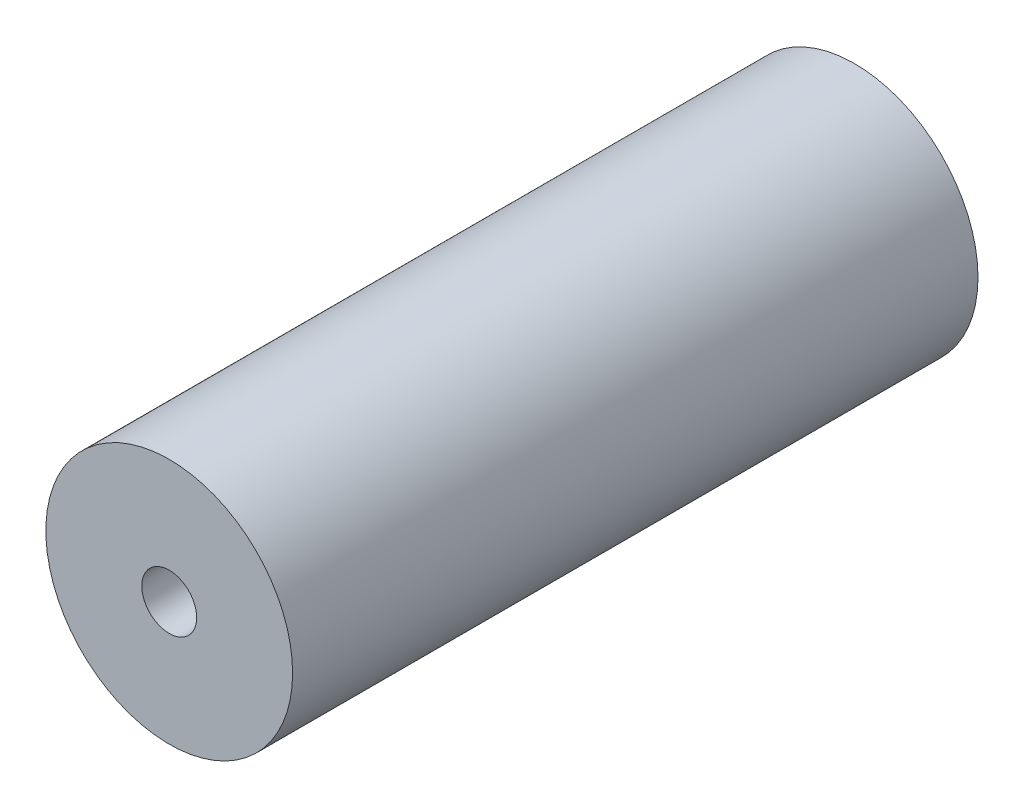
from build123d import *

# Parameters (mm, degrees)
BOSS_EXTRUDE1_DEPTH      = 50
BOSS_EXTRUDE1_DEPTH_BACK = 50
SKETCH2_R                = 18
SKETCH3_R                = 4
CUT_EXTRUDE1_DEPTH       = 122
SKETCH4_R                = 1.5
CUT_EXTRUDE2_DEPTH       = 5


with BuildPart() as part:
    # Sketch2 → Boss-Extrude1 (new, two sides: drawn at the far end of the back side and taken through both)
    with BuildSketch(Plane.XY.offset(-BOSS_EXTRUDE1_DEPTH_BACK)):
        Circle(SKETCH2_R)
    extrude(amount=BOSS_EXTRUDE1_DEPTH + BOSS_EXTRUDE1_DEPTH_BACK)

    # Sketch3 → Cut-Extrude1 (cut)
    with BuildSketch(Plane.XY.offset(50)):
        Circle(SKETCH3_R)
    extrude(amount=-CUT_EXTRUDE1_DEPTH, mode=Mode.SUBTRACT)

    # Sketch4 → Cut-Extrude2 (cut)
    with BuildSketch(Plane(origin=(0, 0, -50), x_dir=(-1, 0, 0), z_dir=(0, 0, -1))):
        with Locations((0, 14)):
            Circle(SKETCH4_R)
        with Locations((14, 0)):
            Circle(SKETCH4_R)
        with Locations((0, -14)):
            Circle(SKETCH4_R)
        with Locations((-14, 0)):
            Circle(SKETCH4_R)
    extrude(amount=-CUT_EXTRUDE2_DEPTH, mode=Mode.SUBTRACT)


solid = part.part
